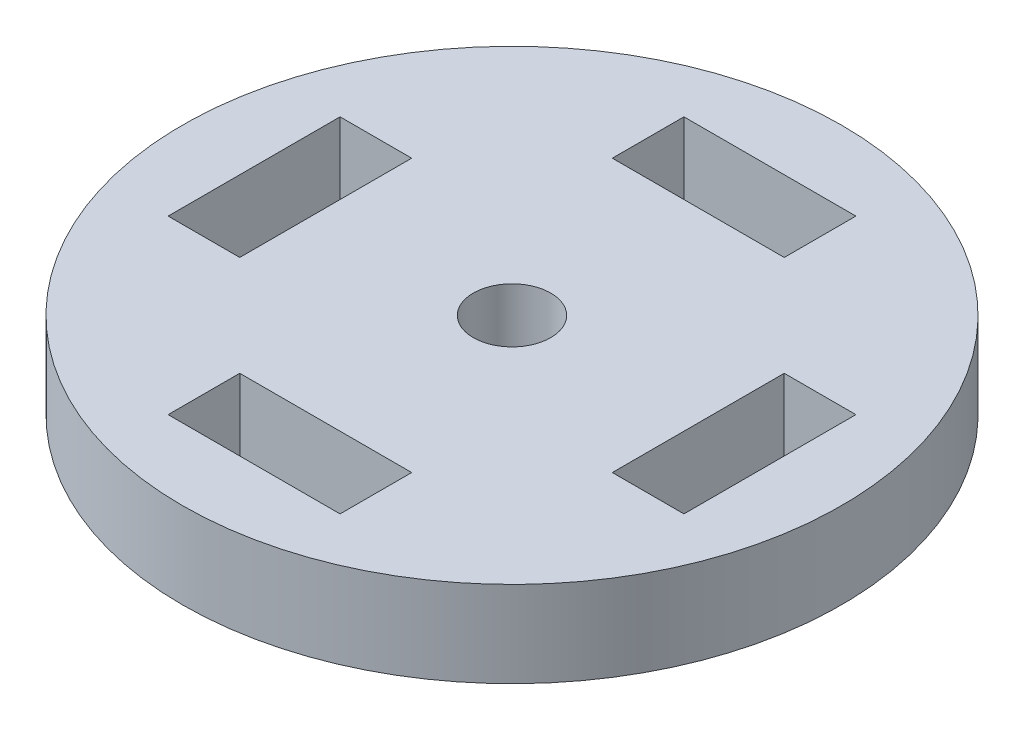
from build123d import *

# Parameters (mm, degrees)
SKETCH5_R           = 11.5
BOSS_EXTRUDE2_DEPTH = 3
SKETCH3_W           = 6
SKETCH3_H           = 2.5
SKETCH3_W_2         = 2.5
SKETCH3_H_2         = 6
CUT_EXTRUDE1_DEPTH  = 3
SKETCH6_R           = 1.35
CUT_EXTRUDE2_DEPTH  = 3


with BuildPart() as part:
    # Sketch5 → Boss-Extrude2 (new body)
    with BuildSketch(Plane(origin=(0, 0, 0), x_dir=(1, 0, 0), z_dir=(0, 1, 0))):
        with Locations(Location((0, 0, 0), (0, 0, 270))):
            Circle(SKETCH5_R)
    extrude(amount=BOSS_EXTRUDE2_DEPTH)

    # Sketch3 → Cut-Extrude1 (cut)
    with BuildSketch(Plane(origin=(0, 0, 0), x_dir=(1, 0, 0), z_dir=(0, 1, 0))):
        with Locations((0, 7.75)):
            Rectangle(SKETCH3_W, SKETCH3_H)
        with Locations((7.75, 0)):
            Rectangle(SKETCH3_W_2, SKETCH3_H_2)
        with Locations((0, -7.75)):
            Rectangle(SKETCH3_W, SKETCH3_H)
        with Locations((-7.75, 0)):
            Rectangle(SKETCH3_W_2, SKETCH3_H_2)
    extrude(amount=CUT_EXTRUDE1_DEPTH, mode=Mode.SUBTRACT)

    # Sketch6 → Cut-Extrude2 (cut)
    with BuildSketch(Plane(origin=(0, 3, 0), x_dir=(1, 0, 0), z_dir=(0, 1, 0))):
        with Locations(Location((0, 0, 0), (0, 0, 270))):
            Circle(SKETCH6_R)
    extrude(amount=-CUT_EXTRUDE2_DEPTH, mode=Mode.SUBTRACT)


solid = part.part
